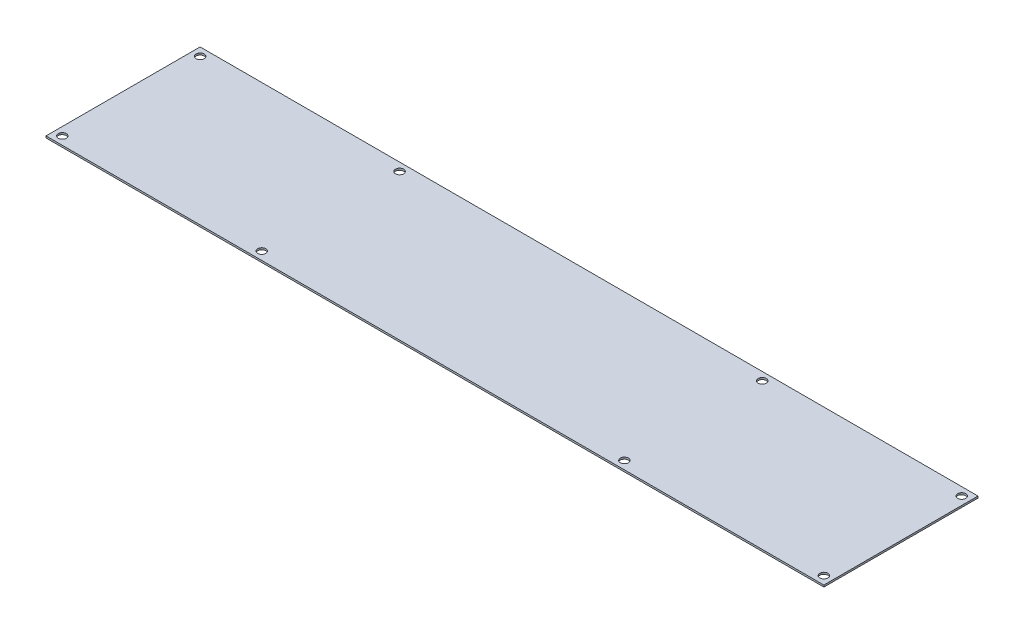
from build123d import *

# Parameters (mm, degrees)
SKETCH1_W            = 429
SKETCH1_H            = 85
BOSS_EXTRUDE1_DEPTH  = 1
M4_CLEARANCE_HOLE1_D = 4.5


with BuildPart() as part:
    # Sketch1 → Boss-Extrude1 (new body)
    with BuildSketch(Plane(origin=(0, 0, 0), x_dir=(1, 0, 0), z_dir=(0, 1, 0))):
        Rectangle(SKETCH1_W, SKETCH1_H)
    extrude(amount=BOSS_EXTRUDE1_DEPTH)

    # M4 Clearance Hole1 (through all)
    with Locations(Plane(origin=(0, 1, 0), x_dir=(1, 0, 0), z_dir=(0, 1, 0))):
        with Locations((-210, 38), (210, 38), (-100, 38), (100, 38), (100, -38), (-100, -38), (210, -38), (-210, -38)):
            Hole(M4_CLEARANCE_HOLE1_D / 2)


solid = part.part
